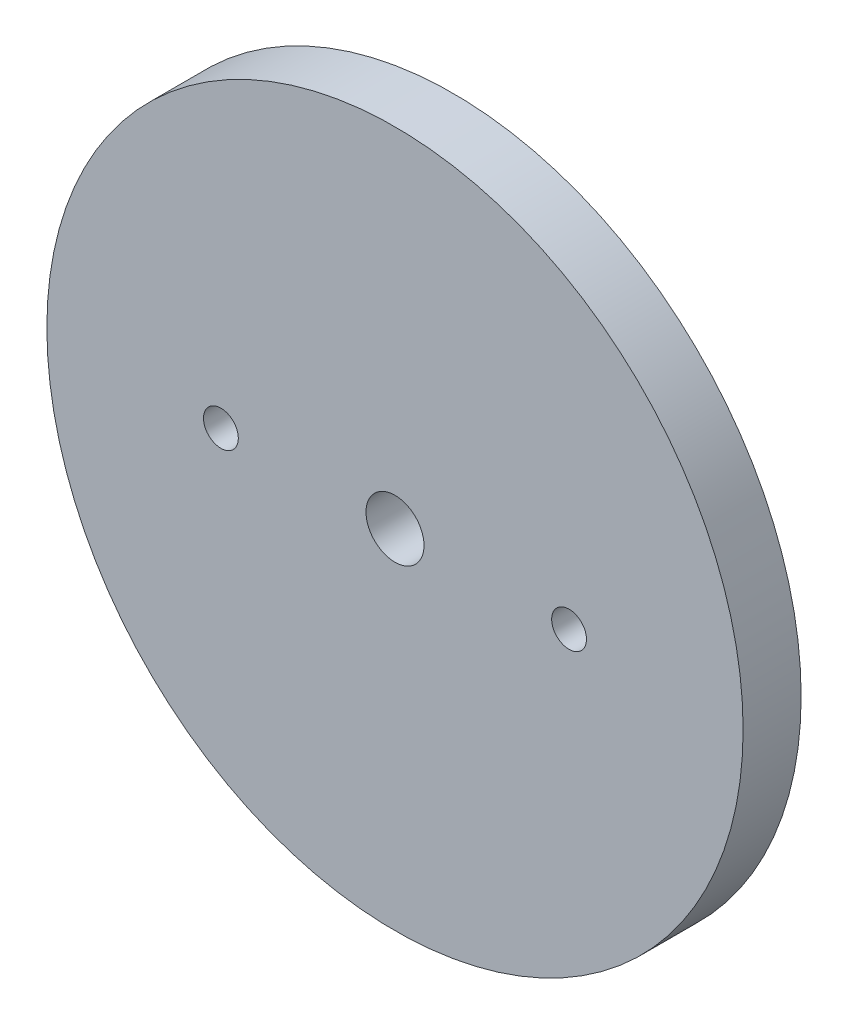
from build123d import *

# Parameters (mm, degrees)
SKETCH1_R           = 60
BOSS_EXTRUDE1_DEPTH = 10
SKETCH2_R           = 5
CUT_EXTRUDE1_DEPTH  = 10
SKETCH3_R           = 3
CUT_EXTRUDE2_DEPTH  = 10


with BuildPart() as part:
    # Sketch1 → Boss-Extrude1 (new body)
    with BuildSketch(Plane.XY):
        Circle(SKETCH1_R)
    extrude(amount=BOSS_EXTRUDE1_DEPTH)

    # Sketch2 → Cut-Extrude1 (cut)
    with BuildSketch(Plane.XY.offset(10)):
        Circle(SKETCH2_R)
    extrude(amount=-CUT_EXTRUDE1_DEPTH, mode=Mode.SUBTRACT)

    # Sketch3 → Cut-Extrude2 (cut)
    with BuildSketch(Plane.XY.offset(10)):
        with Locations((-30, 0)):
            Circle(SKETCH3_R)
        with Locations((30, 0)):
            Circle(SKETCH3_R)
    extrude(amount=-CUT_EXTRUDE2_DEPTH, mode=Mode.SUBTRACT)


solid = part.part
